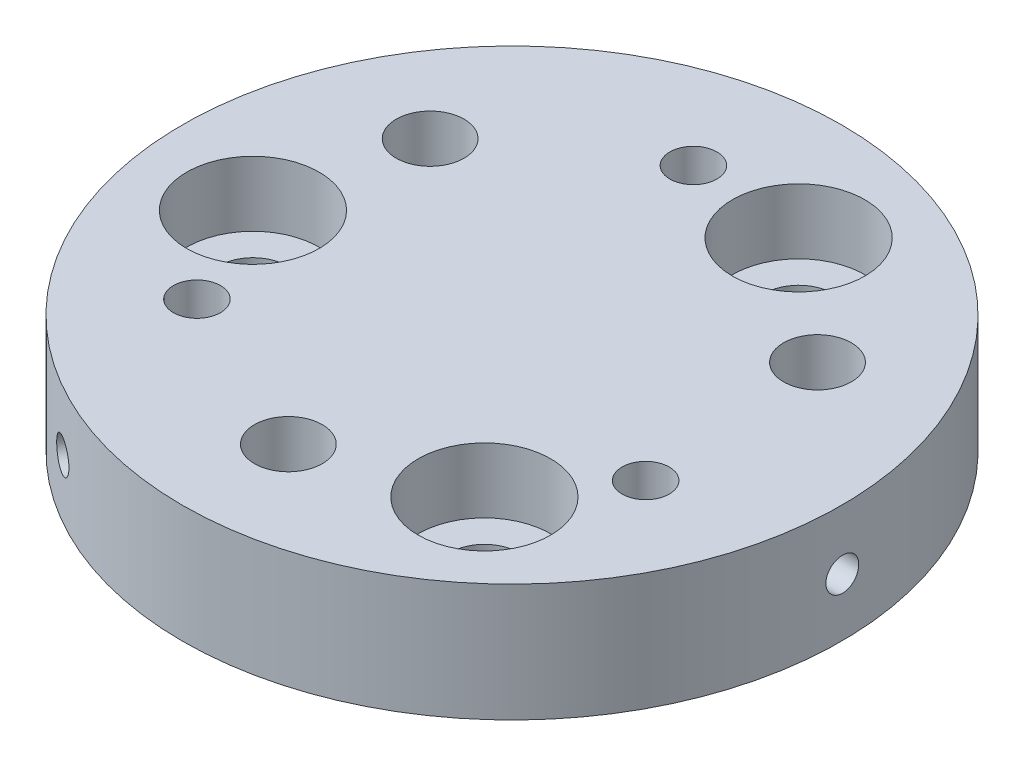
from build123d import *

# Parameters (mm, degrees)
SKETCH1_R                                      = 17.78
BOSS_EXTRUDE1_DEPTH                            = 6.35
CBORE_FOR_6_SOCKET_HEAD_CAP_SCREW1_D           = 3.6576
CBORE_FOR_6_SOCKET_HEAD_CAP_SCREW1_CBORE_D     = 7.14502
CBORE_FOR_6_SOCKET_HEAD_CAP_SCREW1_CBORE_DEPTH = 3.5052
CIRPATTERN1_COUNT                              = 3
CIRPATTERN3_COUNT                              = 3
CBORE_FOR_6_SOCKET_HEAD_CAP_SCREW2_D           = 3.6576
CBORE_FOR_6_SOCKET_HEAD_CAP_SCREW2_CBORE_D     = 7.14502
CBORE_FOR_6_SOCKET_HEAD_CAP_SCREW2_CBORE_DEPTH = 3.5052
CIRPATTERN4_COUNT                              = 3
SKETCH19_R                                     = 1.27
CUT_EXTRUDE1_DEPTH                             = 26.934134043
CIRPATTERN5_COUNT                              = 3


with BuildPart() as part:
    # Sketch1 → Boss-Extrude1 (new body)
    with BuildSketch(Plane(origin=(0, 0, 0), x_dir=(1, 0, 0), z_dir=(0, 1, 0))):
        with Locations(Location((0, 0, 0), (0, 0, 270))):
            Circle(SKETCH1_R)
    extrude(amount=BOSS_EXTRUDE1_DEPTH)

    # CBORE for #6 Socket Head Cap Screw1 (through all)
    with Locations(Plane(origin=(0, 6.35, 0), x_dir=(1, 0, 0), z_dir=(0, 1, 0))):
        with Locations((7.755232511, -9.242326206)):
            cbore_for_6_socket_head_cap_screw1 = CounterBoreHole(CBORE_FOR_6_SOCKET_HEAD_CAP_SCREW1_D / 2, CBORE_FOR_6_SOCKET_HEAD_CAP_SCREW1_CBORE_D / 2, CBORE_FOR_6_SOCKET_HEAD_CAP_SCREW1_CBORE_DEPTH)

    # CirPattern1: CBORE for #6 Socket Head Cap Screw1 ×3 about axis
    cirpattern1_axis = Axis((0, 0, 0), (0, 1, 0))
    for i in range(1, CIRPATTERN1_COUNT):
        add(cbore_for_6_socket_head_cap_screw1.rotate(cirpattern1_axis, i * 360 / CIRPATTERN1_COUNT), mode=Mode.SUBTRACT)

    # Sketch15 → Tap Drill for #2-56 Tap1 (revolve, cut)
    with BuildSketch(Plane(origin=(-8.835910942, 3.105629072, 15.4290336), x_dir=(0.8677746681735184, 0, 0.49695787072581915), z_dir=(0, 1, 0))):
        Polygon((0, 0), (0, 7.095959572), (0.889, 6.35), (0.889, 0), align=None)
    tap_drill_for_2_56_tap1 = revolve(axis=Axis((-11.991593421, 3.105629072, 20.939402743), (0.49695787072581915, 0, -0.8677746681735184)), mode=Mode.SUBTRACT)

    # CirPattern3: Tap Drill for #2-56 Tap1 ×3 about axis
    cirpattern3_axis = Axis((0, 6.35, 0), (0, -1, 0))
    for i in range(1, CIRPATTERN3_COUNT):
        add(tap_drill_for_2_56_tap1.rotate(cirpattern3_axis, i * 360 / CIRPATTERN3_COUNT), mode=Mode.SUBTRACT)

    # CBORE for #6 Socket Head Cap Screw2 (through all)
    with Locations(Plane(origin=(10.448596497, 0, -6.0325), x_dir=(0, 0, -1), z_dir=(0, -1, 0))):
        with Locations((0, 0)):
            cbore_for_6_socket_head_cap_screw2 = CounterBoreHole(CBORE_FOR_6_SOCKET_HEAD_CAP_SCREW2_D / 2, CBORE_FOR_6_SOCKET_HEAD_CAP_SCREW2_CBORE_D / 2, CBORE_FOR_6_SOCKET_HEAD_CAP_SCREW2_CBORE_DEPTH)

    # CirPattern4: CBORE for #6 Socket Head Cap Screw2 ×3 about axis
    cirpattern4_axis = Axis((0, 0, 0), (0, 1, 0))
    for i in range(1, CIRPATTERN4_COUNT):
        add(cbore_for_6_socket_head_cap_screw2.rotate(cirpattern4_axis, i * 360 / CIRPATTERN4_COUNT), mode=Mode.SUBTRACT)

    # Sketch19 → Cut-Extrude1 (cut, through all)
    with BuildSketch(Plane(origin=(0, 6.35, 0), x_dir=(1, 0, 0), z_dir=(0, 1, 0))):
        with Locations(Location((11.33739147, -4.126473029, 0), (0, 0, 270))):
            Circle(SKETCH19_R)
    cut_extrude1 = extrude(amount=-CUT_EXTRUDE1_DEPTH, mode=Mode.SUBTRACT)

    # CirPattern5: Cut-Extrude1 ×3 about axis
    cirpattern5_axis = Axis((0, 0, 0), (0, 1, 0))
    for i in range(1, CIRPATTERN5_COUNT):
        add(cut_extrude1.rotate(cirpattern5_axis, i * 360 / CIRPATTERN5_COUNT), mode=Mode.SUBTRACT)


solid = part.part
